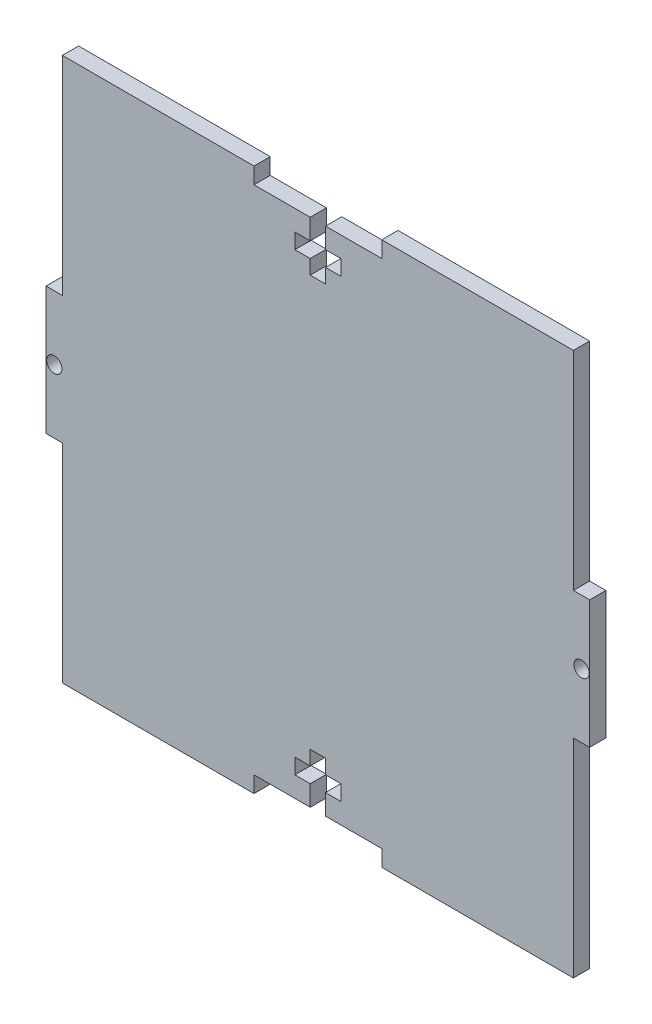
from build123d import *

# Parameters (mm, degrees)
SKETCH1_R           = 1.5
BOSS_EXTRUDE1_DEPTH = 3.18


with BuildPart() as part:
    # Sketch1 → Boss-Extrude1 (new body)
    with BuildSketch(Plane.XY):
        Polygon((-50, 53.18), (-12.5, 53.18), (-12.5, 50), (-1.5, 50), (-1.5, 46), (-4.5, 46), (-4.5, 43), (-1.5, 43), (-1.5, 40.18), (1.5, 40.18), (1.5, 43), (4.5, 43), (4.5, 46), (1.5, 46), (1.5, 50), (12.5, 50), (12.5, 53.18), (50, 53.18), (50, 12.5), (53.18, 12.5), (53.18, -12.5), (50, -12.5), (50, -53.18), (12.5, -53.18), (12.5, -50), (1.5, -50), (1.5, -46), (4.5, -46), (4.5, -43), (1.5, -43), (1.5, -40.18), (-1.5, -40.18), (-1.5, -43), (-4.5, -43), (-4.5, -46), (-1.5, -46), (-1.5, -50), (-12.5, -50), (-12.5, -53.18), (-50, -53.18), (-50, -12.5), (-53.18, -12.5), (-53.18, 12.5), (-50, 12.5), align=None)
        with Locations(Location((-51.59, 0, 0), (0, 0, 180))):
            Circle(SKETCH1_R, mode=Mode.SUBTRACT)
        with Locations(Location((51.59, 0, 0), (0, 0, 180))):
            Circle(SKETCH1_R, mode=Mode.SUBTRACT)
    extrude(amount=BOSS_EXTRUDE1_DEPTH)


solid = part.part
